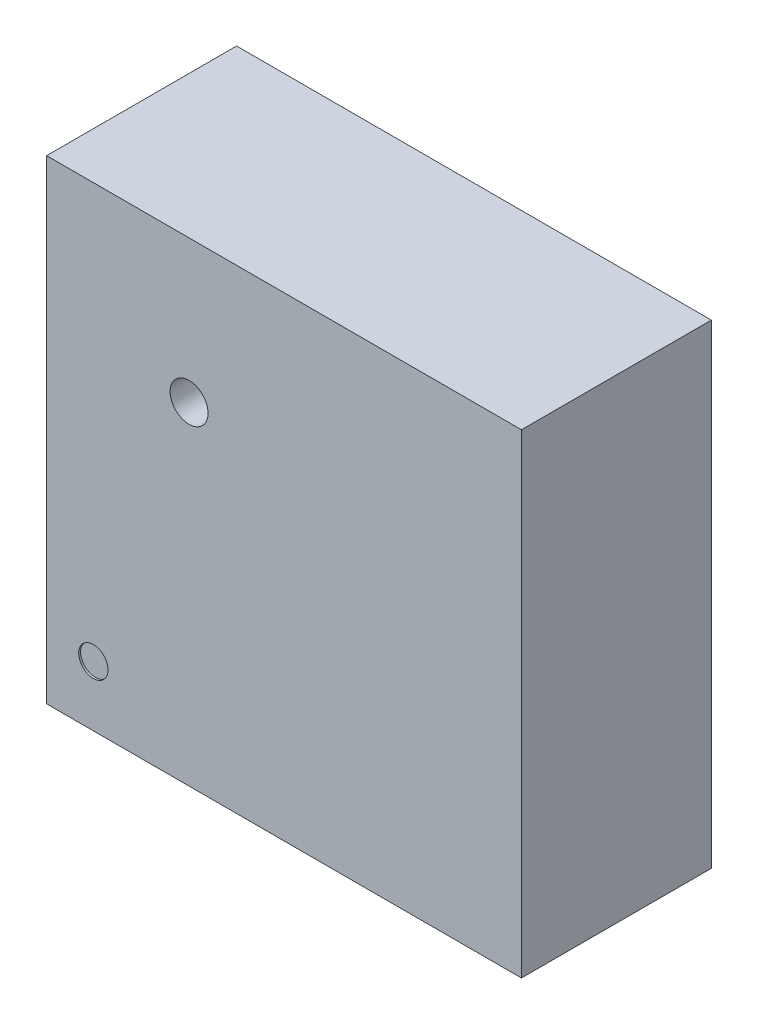
from build123d import *

# Parameters (mm, degrees)
SKETCH1_W           = 2.5
SKETCH1_H           = 2.5
BOSS_EXTRUDE1_DEPTH = 1
SKETCH2_R           = 0.1
CUT_EXTRUDE1_DEPTH  = 0.2
SKETCH3_R           = 0.077337361
CUT_EXTRUDE2_DEPTH  = 0.01


with BuildPart() as part:
    # Sketch1 → Boss-Extrude1 (new body)
    with BuildSketch(Plane.XY):
        Rectangle(SKETCH1_W, SKETCH1_H)
    extrude(amount=BOSS_EXTRUDE1_DEPTH)

    # Sketch2 → Cut-Extrude1 (cut)
    with BuildSketch(Plane.XY.offset(1)):
        with Locations((-0.5, 0.5)):
            Circle(SKETCH2_R)
    extrude(amount=-CUT_EXTRUDE1_DEPTH, mode=Mode.SUBTRACT)

    # Sketch3 → Cut-Extrude2 (cut)
    with BuildSketch(Plane.XY.offset(1)):
        with Locations((-1.004038856, -0.933808159)):
            Circle(SKETCH3_R)
    extrude(amount=-CUT_EXTRUDE2_DEPTH, mode=Mode.SUBTRACT)


solid = part.part
